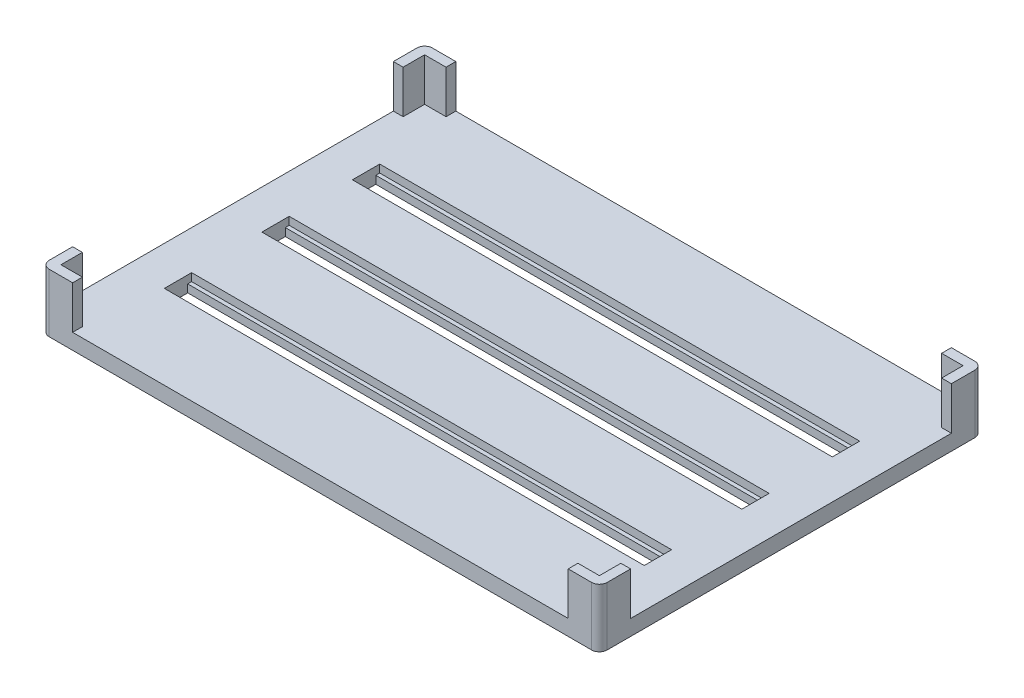
from build123d import *

# Parameters (mm, degrees)
BOSS_EXTRUDE1_DEPTH = 15
SKETCH2_W           = 138
SKETCH2_H           = 93.2
CUT_EXTRUDE1_DEPTH  = 11
SKETCH3_W           = 2.5
SKETCH3_H           = 82.2
SKETCH3_W_2         = 127
SKETCH3_H_2         = 2.5
CUT_EXTRUDE2_DEPTH  = 11
SKETCH7_W           = 123
SKETCH7_H           = 7
CUT_EXTRUDE6_DEPTH  = 2
SKETCH8_W           = 123
SKETCH8_H           = 5
CUT_EXTRUDE7_DEPTH  = 10


with BuildPart() as part:
    # Sketch1 → Boss-Extrude1 (new body)
    with BuildSketch(Plane(origin=(0, 0, 0), x_dir=(1, 0, 0), z_dir=(0, 1, 0))):
        with BuildLine():
            Line((-69.5, -49.1), (69.5, -49.1))
            ThreePointArc((69.5, -49.1), (70.914213562, -48.514213562), (71.5, -47.1))
            Line((71.5, -47.1), (71.5, 47.1))
            ThreePointArc((71.5, 47.1), (70.914213562, 48.514213562), (69.5, 49.1))
            Line((69.5, 49.1), (-69.5, 49.1))
            ThreePointArc((-69.5, 49.1), (-70.914213562, 48.514213562), (-71.5, 47.1))
            Line((-71.5, 47.1), (-71.5, -47.1))
            ThreePointArc((-71.5, -47.1), (-70.914213562, -48.514213562), (-69.5, -49.1))
        make_face()
    extrude(amount=BOSS_EXTRUDE1_DEPTH)

    # Sketch2 → Cut-Extrude1 (cut)
    with BuildSketch(Plane(origin=(0, 15, 0), x_dir=(1, 0, 0), z_dir=(0, 1, 0))):
        Rectangle(SKETCH2_W, SKETCH2_H)
    extrude(amount=-CUT_EXTRUDE1_DEPTH, mode=Mode.SUBTRACT)

    # Sketch3 → Cut-Extrude2 (cut)
    with BuildSketch(Plane(origin=(0, 15, 0), x_dir=(1, 0, 0), z_dir=(0, 1, 0))):
        with Locations((-70.25, 0)):
            Rectangle(SKETCH3_W, SKETCH3_H)
        with Locations((0, 47.85)):
            Rectangle(SKETCH3_W_2, SKETCH3_H_2)
        with Locations((70.25, 0)):
            Rectangle(SKETCH3_W, SKETCH3_H)
        with Locations((0, -47.85)):
            Rectangle(SKETCH3_W_2, SKETCH3_H_2)
    extrude(amount=-CUT_EXTRUDE2_DEPTH, mode=Mode.SUBTRACT)

    # Sketch7 → Cut-Extrude6 (cut)
    with BuildSketch(Plane(origin=(0, 4, 0), x_dir=(1, 0, 0), z_dir=(0, 1, 0))):
        with Locations((0, 0.9)):
            Rectangle(SKETCH7_W, SKETCH7_H)
        with Locations((0, 24.1)):
            Rectangle(SKETCH7_W, SKETCH7_H)
        with Locations((0, -24.1)):
            Rectangle(SKETCH7_W, SKETCH7_H)
    extrude(amount=-CUT_EXTRUDE6_DEPTH, mode=Mode.SUBTRACT)

    # Sketch8 → Cut-Extrude7 (cut)
    with BuildSketch(Plane(origin=(0, 2, 0), x_dir=(1, 0, 0), z_dir=(0, 1, 0))):
        with Locations((0, 0.9)):
            Rectangle(SKETCH8_W, SKETCH8_H)
        with Locations((0, 24.1)):
            Rectangle(SKETCH8_W, SKETCH8_H)
        with Locations((0, -24.1)):
            Rectangle(SKETCH8_W, SKETCH8_H)
    extrude(amount=-CUT_EXTRUDE7_DEPTH, mode=Mode.SUBTRACT)


solid = part.part
